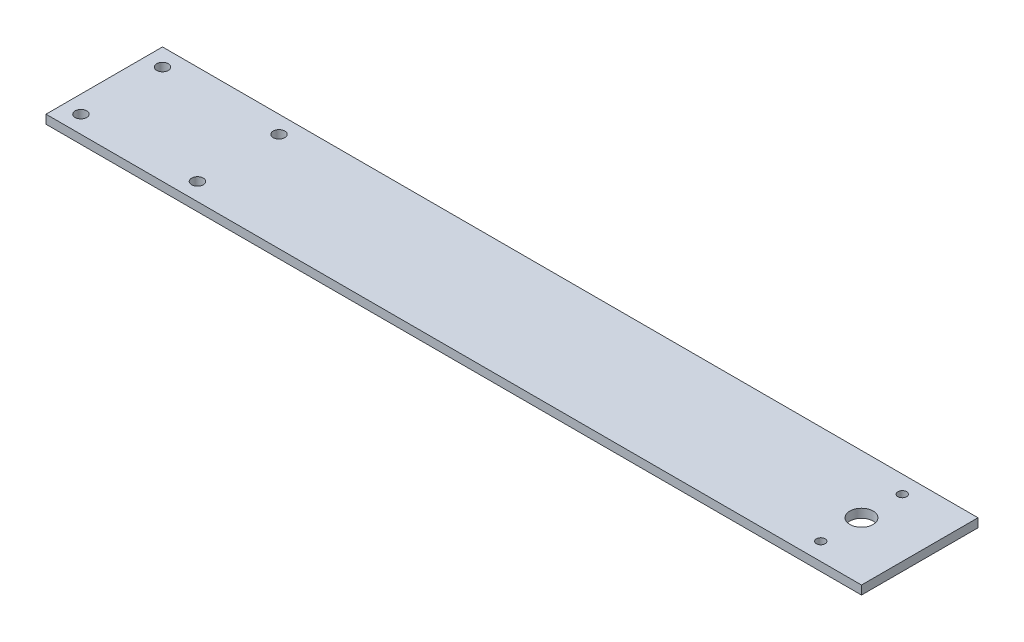
from build123d import *

# Parameters (mm, degrees)
SKETCH1_W           = 280
SKETCH1_H           = 40
SKETCH1_R           = 2
SKETCH1_R_2         = 4
SKETCH1_R_3         = 1.5
BOSS_EXTRUDE1_DEPTH = 3


with BuildPart() as part:
    # Sketch1 → Boss-Extrude1 (new body)
    with BuildSketch(Plane(origin=(0, 0, 0), x_dir=(1, 0, 0), z_dir=(0, 1, 0))):
        Rectangle(SKETCH1_W, SKETCH1_H)
        with Locations(Location((-134, 14, 0), (0, 0, 270))):
            Circle(SKETCH1_R, mode=Mode.SUBTRACT)
        with Locations(Location((-94, 14, 0), (0, 0, 270))):
            Circle(SKETCH1_R, mode=Mode.SUBTRACT)
        with Locations(Location((-94, -14, 0), (0, 0, 270))):
            Circle(SKETCH1_R, mode=Mode.SUBTRACT)
        with Locations(Location((-134, -14, 0), (0, 0, 270))):
            Circle(SKETCH1_R, mode=Mode.SUBTRACT)
        with Locations(Location((120, 0, 0), (0, 0, 270))):
            Circle(SKETCH1_R_2, mode=Mode.SUBTRACT)
        with Locations(Location((120, 14, 0), (0, 0, 270))):
            Circle(SKETCH1_R_3, mode=Mode.SUBTRACT)
        with Locations(Location((120, -14, 0), (0, 0, 270))):
            Circle(SKETCH1_R_3, mode=Mode.SUBTRACT)
    extrude(amount=BOSS_EXTRUDE1_DEPTH)


solid = part.part
